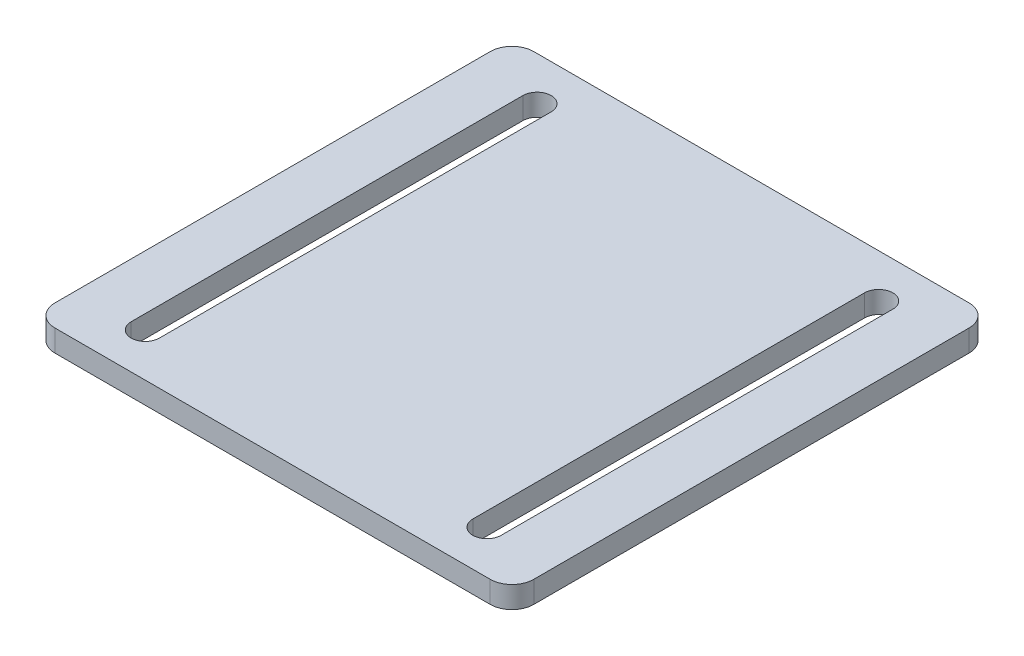
from build123d import *

# Parameters (mm, degrees)
BOSS_EXTRUDE1_DEPTH = 2.54


with BuildPart() as part:
    # Sketch1 → Boss-Extrude1 (new body)
    with BuildSketch(Plane(origin=(0, 0, 0), x_dir=(1, 0, 0), z_dir=(0, 1, 0))):
        with BuildLine():
            Line((-27.94, 0), (-27.94, 25.4))
            ThreePointArc((-27.94, 25.4), (-27.196051224, 27.196051224), (-25.4, 27.94))
            Line((-25.4, 27.94), (0, 27.94))
            Line((0, 27.94), (25.4, 27.94))
            ThreePointArc((25.4, 27.94), (27.196051224, 27.196051224), (27.94, 25.4))
            Line((27.94, 25.4), (27.94, 0))
            Line((27.94, 0), (27.94, -25.4))
            ThreePointArc((27.94, -25.4), (27.196051224, -27.196051224), (25.4, -27.94))
            Line((25.4, -27.94), (0, -27.94))
            Line((0, -27.94), (-25.4, -27.94))
            ThreePointArc((-25.4, -27.94), (-27.196051224, -27.196051224), (-27.94, -25.4))
            Line((-27.94, -25.4), (-27.94, 0))
        make_face()
        with BuildLine():
            Line((-18.288, 22.86), (-18.288, -22.86))
            ThreePointArc((-18.288, -22.86), (-19.939, -24.511), (-21.59, -22.86))
            Line((-21.59, -22.86), (-21.59, 22.86))
            ThreePointArc((-21.59, 22.86), (-19.939, 24.511), (-18.288, 22.86))
        make_face(mode=Mode.SUBTRACT)
        with BuildLine():
            Line((18.288, 22.86), (18.288, -22.86))
            ThreePointArc((18.288, -22.86), (19.939, -24.511), (21.59, -22.86))
            Line((21.59, -22.86), (21.59, 22.86))
            ThreePointArc((21.59, 22.86), (19.939, 24.511), (18.288, 22.86))
        make_face(mode=Mode.SUBTRACT)
    extrude(amount=BOSS_EXTRUDE1_DEPTH)


solid = part.part
